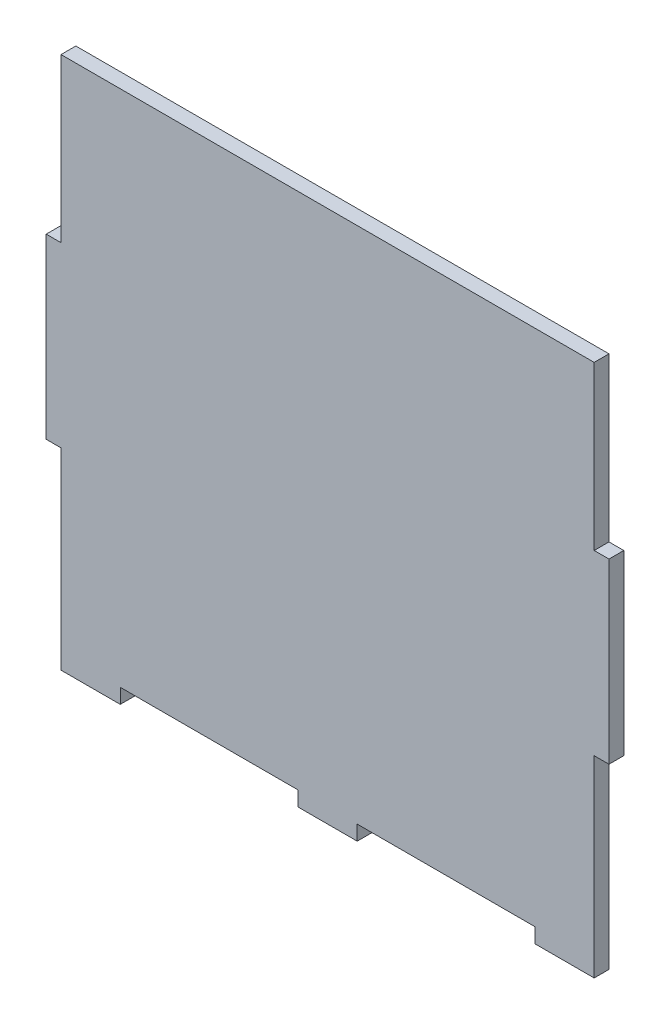
from build123d import *

# Parameters (mm, degrees)
SKETCH1_W           = 6.35
SKETCH1_H           = 76.2
BOSS_EXTRUDE1_DEPTH = 6.35


with BuildPart() as part:
    # Sketch1 → Boss-Extrude1 (new body)
    with BuildSketch(Plane.XY):
        Polygon((119.544333082, -48.615768355), (94.144333082, -48.615768355), (94.144333082, -42.265768355), (17.944333082, -42.265768355), (17.944333082, -48.615768355), (5.244333082, -48.615768355), (-7.455666918, -48.615768355), (-7.455666918, -42.265768355), (-83.655666918, -42.265768355), (-83.655666918, -48.615768355), (-109.055666918, -48.615768355), (-109.055666918, 179.984231645), (119.544333082, 179.984231645), align=None)
        with Locations((-112.230666918, 72.034231645)):
            Rectangle(SKETCH1_W, SKETCH1_H)
        with Locations((122.719333082, 72.034231645)):
            Rectangle(SKETCH1_W, SKETCH1_H)
    extrude(amount=BOSS_EXTRUDE1_DEPTH)


solid = part.part
